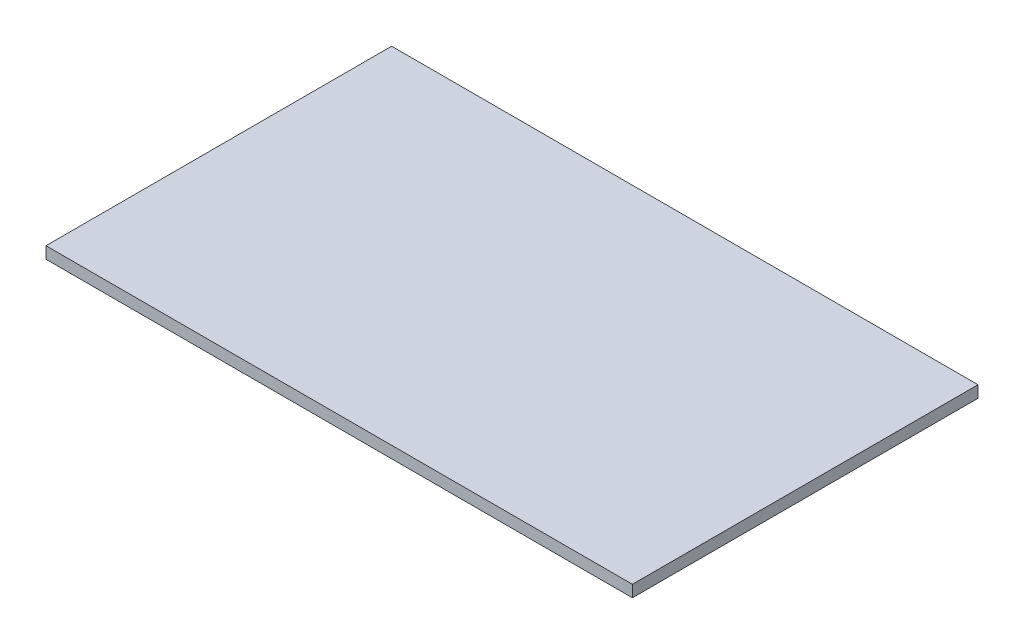
from build123d import *

# Parameters (mm, degrees)
SKETCH_1_W      = 5000
SKETCH_1_H      = 2946.869311244
EXTRUDE_1_DEPTH = 100


with BuildPart() as part:
    # 草图1 → 凸台-拉伸1 (new body)
    with BuildSketch(Plane(origin=(0, 0, 0), x_dir=(1, 0, 0), z_dir=(0, 1, 0))):
        Rectangle(SKETCH_1_W, SKETCH_1_H)
    extrude(amount=EXTRUDE_1_DEPTH)


solid = part.part
